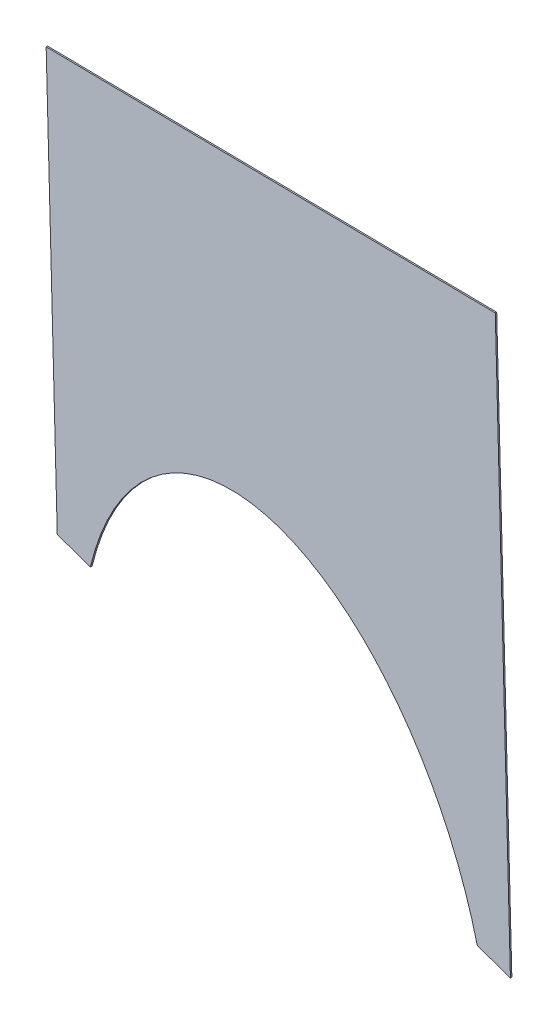
from build123d import *

# Parameters (mm, degrees)
BOSS_EXTRUDE1_DEPTH = 1.5
CUT_EXTRUDE6_DEPTH  = 11.5
CUT_EXTRUDE7_DEPTH  = 11.5


with BuildPart() as part:
    # 3DSketch1 → Boss-Extrude1 (new, along a direction that is not the sketch's normal)
    with BuildSketch(Plane(origin=(-11.663984258, 358.235252064, 0), x_dir=(0.8242948566390451, -0.5203008813923206, 0.22321510285101764), z_dir=(-0.26553281531955075, -0.007074831163105001, 0.964075863587761))):
        Polygon((0, 0), (489.889504132, 504.199636792), (815.132069395, 0), (238.511214526, -369.746400314), align=None)
    extrude(amount=BOSS_EXTRUDE1_DEPTH, dir=(0, 0, 1))

    # Sketch2 → Cut-Extrude6 (cut)
    with BuildSketch(Plane(origin=(-0.533410404, -0.014212136, 1.936664949), x_dir=(0.9641018224173596, -0.0019485492019291684, 0.26552566574162595), z_dir=(-0.26553281531954953, -0.007074831163105186, 0.9640758635877613))):
        with BuildLine():
            ThreePointArc((635.382584147, -65.776722047), (337.840777347, 133.826895304), (50.610501363, -80.349432548))
            Line((50.610501363, -80.349432548), (635.382584147, -65.776722047))
        make_face()
    extrude(amount=-CUT_EXTRUDE6_DEPTH, mode=Mode.SUBTRACT)

    # Sketch3 → Cut-Extrude7 (cut)
    with BuildSketch(Plane(origin=(-0.533410404, -0.014212136, 1.936664949), x_dir=(0.9641018224173596, -0.0019485492019291684, 0.26552566574162595), z_dir=(-0.26553281531954953, -0.007074831163105186, 0.9640758635877613))):
        Polygon((50.610501363, -80.349432548), (50.610501363, -106.198699681), (633.779172918, -106.198699681), (635.382584147, -65.776722047), (592.923417402, -33.337692785), (162.965228398, -33.337692785), align=None)
    extrude(amount=-CUT_EXTRUDE7_DEPTH, mode=Mode.SUBTRACT)


solid = part.part
